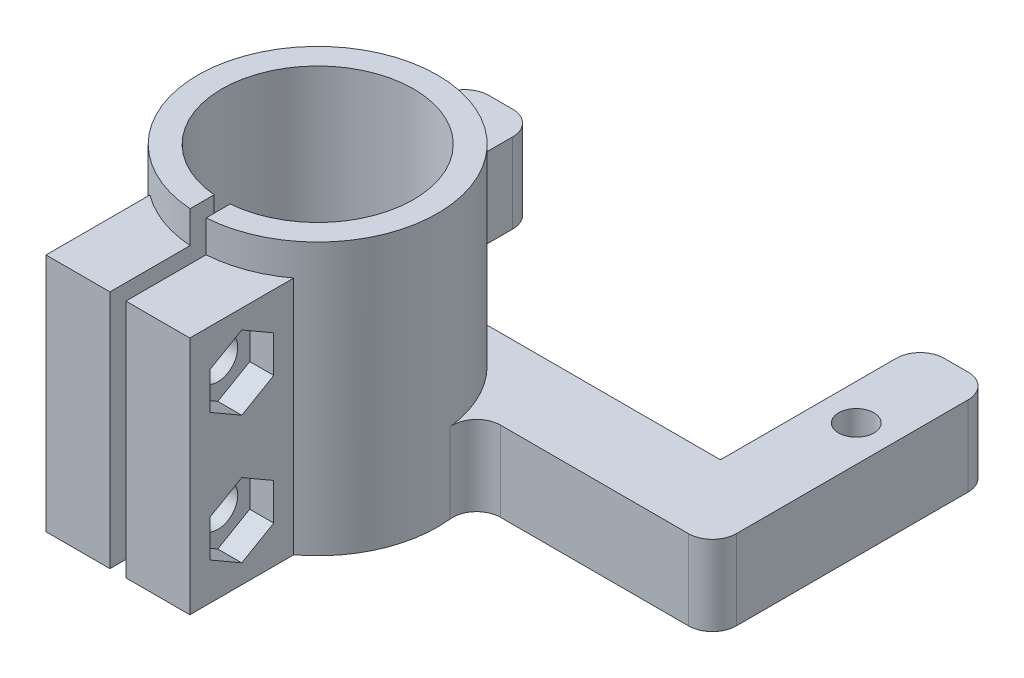
from build123d import *

# Parameters (mm, degrees)
SKETCH_1_R                  = 7.5
SKETCH_1_R_2                = 6
EXTRUDE_1_DEPTH             = 17
CUT_EXTRUDE_1_REACH         = 25.88
CUT_EXTRUDE_1_END_RADIUS    = 6
SKETCH_2_W                  = 1
SKETCH_2_H                  = 17
SKETCH_3_W                  = 4
SKETCH_3_H                  = 17
EXTRUDE_2_DEPTH             = 5
EXTRUDE_2_DIRECTION_2_REACH = 25.88
CUT_EXTRUDE_START           = -2
CUT_EXTRUDE_4_DEPTH         = 2
CUT_EXTRUDE_2_REACH         = 26.274
SKETCH_4_R                  = 1.25
CUT_EXTRUDE_3_DEPTH         = 1.5
EXTRUDE_6_DEPTH             = 5
SKETCH_13_W                 = 4.5
SKETCH_13_H                 = 12.5
EXTRUDE_7_DEPTH             = 5
CUT_EXTRUDE_5_REACH         = 34.2
SKETCH_11_R                 = 1.1
FILLET_1_R                  = 1.5


with BuildPart() as part:
    # 草图1 → 凸台-拉伸1 (new body)
    with BuildSketch(Plane(origin=(0, 0, 0), x_dir=(1, 0, 0), z_dir=(0, 1, 0))):
        with Locations(Location((0, 0, 0), (0, 0, 270))):
            Circle(SKETCH_1_R)
        with Locations(Location((0, 0, 0), (0, 0, 270))):
            Circle(SKETCH_1_R_2, mode=Mode.SUBTRACT)
    extrude(amount=EXTRUDE_1_DEPTH)

    # 切除-拉伸1: up to this cylinder (the profile starts outside it)
    cut_extrude_1_end = Plane(origin=(0, 8.5, 0), z_dir=(0, -1, 0)) * Cylinder(CUT_EXTRUDE_1_END_RADIUS, 64.76, mode=Mode.PRIVATE)
    # 草图2 → 切除-拉伸1 (cut, up to the surface)
    with BuildSketch(Plane.XY.offset(7.5), mode=Mode.PRIVATE) as cut_extrude_1_sk1:
        with Locations((0, 8.5)):
            Rectangle(SKETCH_2_W, SKETCH_2_H)
    cut_extrude_1_tool1 = extrude(cut_extrude_1_sk1.sketch, amount=-CUT_EXTRUDE_1_REACH, mode=Mode.PRIVATE) - cut_extrude_1_end
    add(cut_extrude_1_tool1.solids().sort_by_distance((0, 8.5, 7.5))[0], mode=Mode.SUBTRACT)

    # 草图3 → 凸台-拉伸2 (add)
    with BuildSketch(Plane.XY.offset(7.5)):
        with Locations((-2.5, 8.5)):
            Rectangle(SKETCH_3_W, SKETCH_3_H)
        with Locations((2.5, 8.5)):
            Rectangle(SKETCH_3_W, SKETCH_3_H)
    extrude(amount=EXTRUDE_2_DEPTH)

    # 草图3 → 凸台-拉伸2 direction 2 (add, up to next)
    with BuildSketch(Plane.XY.offset(7.5), mode=Mode.PRIVATE) as extrude_2_direction_2_sk1:
        with Locations((-2.5, 8.5)):
            Rectangle(SKETCH_3_W, SKETCH_3_H)
    extrude_2_direction_2_tool1 = extrude(extrude_2_direction_2_sk1.sketch, amount=-EXTRUDE_2_DIRECTION_2_REACH, mode=Mode.PRIVATE) - part.part
    # 草图3 → 凸台-拉伸2 direction 2 (add, up to next)
    with BuildSketch(Plane.XY.offset(7.5), mode=Mode.PRIVATE) as extrude_2_direction_2_sk2:
        with Locations((2.5, 8.5)):
            Rectangle(SKETCH_3_W, SKETCH_3_H)
    extrude_2_direction_2_tool2 = extrude(extrude_2_direction_2_sk2.sketch, amount=-EXTRUDE_2_DIRECTION_2_REACH, mode=Mode.PRIVATE) - part.part
    add(extrude_2_direction_2_tool1.solids().sort_by_distance((-2.5, 8.5, 7.5))[0])
    add(extrude_2_direction_2_tool2.solids().sort_by_distance((2.5, 8.5, 7.5))[0])

    # 草图7 → 切除-拉伸4 (cut)
    with BuildSketch(Plane(origin=(0, 17, 0), x_dir=(1, 0, 0), z_dir=(0, 1, 0)).offset(CUT_EXTRUDE_START)):
        with BuildLine():
            Line((-4.5, -6), (-4.5, -12.5))
            Line((-4.5, -12.5), (4.5, -12.5))
            Line((4.5, -12.5), (4.5, -6))
            ThreePointArc((4.5, -6), (0, -7.5), (-4.5, -6))
        make_face()
    extrude(amount=CUT_EXTRUDE_4_DEPTH, mode=Mode.SUBTRACT)

    # 切除-拉伸2: up to this face of the body (flat: up to its plane)
    cut_extrude_2_end = Plane(part.part.faces().sort_by_distance((4.5, 7.5, 9.25))[0])
    # 草图4 → 切除-拉伸2 (cut, up to the picked face)
    with BuildSketch(Plane.ZY.offset(4.5), mode=Mode.PRIVATE) as cut_extrude_2_sk1:
        with Locations(Location((9.25, 11.5, 0), (0, 0, 270))):
            Circle(SKETCH_4_R)
    cut_extrude_2_tool1 = split(extrude(cut_extrude_2_sk1.sketch, amount=-CUT_EXTRUDE_2_REACH, mode=Mode.PRIVATE), bisect_by=cut_extrude_2_end, keep=Keep.BOTH, mode=Mode.PRIVATE)
    # 草图4 → 切除-拉伸2 (cut, up to the picked face)
    with BuildSketch(Plane.ZY.offset(4.5), mode=Mode.PRIVATE) as cut_extrude_2_sk2:
        with Locations(Location((9.25, 3.5, 0), (0, 0, 270))):
            Circle(SKETCH_4_R)
    cut_extrude_2_tool2 = split(extrude(cut_extrude_2_sk2.sketch, amount=-CUT_EXTRUDE_2_REACH, mode=Mode.PRIVATE), bisect_by=cut_extrude_2_end, keep=Keep.BOTH, mode=Mode.PRIVATE)
    add(cut_extrude_2_tool1.solids().sort_by(Axis((-4.5, 11.5, 9.25), (1, 0, 0)))[0], mode=Mode.SUBTRACT)
    add(cut_extrude_2_tool2.solids().sort_by(Axis((-4.5, 3.5, 9.25), (1, 0, 0)))[0], mode=Mode.SUBTRACT)

    # 草图5 → 切除-拉伸3 (cut)
    with BuildSketch(Plane(origin=(4.5, 0, 0), x_dir=(0, 0, -1), z_dir=(1, 0, 0))):
        Polygon((-9.25, 9.190598923), (-7.25, 10.345299462), (-7.25, 12.654700538), (-9.25, 13.809401077), (-11.25, 12.654700538), (-11.25, 10.345299462), align=None)
        Polygon((-9.25, 1.190598923), (-7.25, 2.345299462), (-7.25, 4.654700538), (-9.25, 5.809401077), (-11.25, 4.654700538), (-11.25, 2.345299462), align=None)
    extrude(amount=-CUT_EXTRUDE_3_DEPTH, mode=Mode.SUBTRACT)

    # 草图12 → 凸台-拉伸6 (add)
    with BuildSketch(Plane(origin=(0, 0, 0), x_dir=(1, 0, 0), z_dir=(0, 1, 0))):
        Polygon((-10.8, 7.5), (22.2, 7.5), (22.2, 2.5), (7.071067812, 2.5), (0, 7.208487923), (-7.071067812, 2.5), (-10.8, 2.5), align=None)
    extrude(amount=EXTRUDE_6_DEPTH)

    # 草图13 → 凸台-拉伸7 (add)
    with BuildSketch(Plane(origin=(0, 0, 0), x_dir=(1, 0, 0), z_dir=(0, 1, 0))):
        with Locations((-8.55, 13.75)):
            Rectangle(SKETCH_13_W, SKETCH_13_H)
        with Locations((19.95, 13.75)):
            Rectangle(SKETCH_13_W, SKETCH_13_H)
    extrude(amount=EXTRUDE_7_DEPTH)

    # 草图11 → 切除-拉伸5 (cut, up to next)
    with BuildSketch(Plane(origin=(0, 5, 0), x_dir=(1, 0, 0), z_dir=(0, 1, 0)), mode=Mode.PRIVATE) as cut_extrude_5_sk1:
        with Locations(Location((-8.55, 13.75, 0), (0, 0, 270))):
            Circle(SKETCH_11_R)
    cut_extrude_5_tool1 = extrude(cut_extrude_5_sk1.sketch, amount=-CUT_EXTRUDE_5_REACH, mode=Mode.PRIVATE) & part.part
    # 草图11 → 切除-拉伸5 (cut, up to next)
    with BuildSketch(Plane(origin=(0, 5, 0), x_dir=(1, 0, 0), z_dir=(0, 1, 0)), mode=Mode.PRIVATE) as cut_extrude_5_sk2:
        with Locations(Location((19.95, 13.75, 0), (0, 0, 270))):
            Circle(SKETCH_11_R)
    cut_extrude_5_tool2 = extrude(cut_extrude_5_sk2.sketch, amount=-CUT_EXTRUDE_5_REACH, mode=Mode.PRIVATE) & part.part
    add(cut_extrude_5_tool1.solids().sort_by_distance((-8.55, 5, -13.75))[0], mode=Mode.SUBTRACT)
    add(cut_extrude_5_tool2.solids().sort_by_distance((19.95, 5, -13.75))[0], mode=Mode.SUBTRACT)

    # 圆角1
    fillet_1_edges = [part.edges().sort_by_distance(p)[0] for p in [
        (-10.8, 2.5, -2.5),
        (-7.071067812, 2.5, -2.5),
        (7.071067812, 2.5, -2.5),
        (22.2, 2.5, -2.5),
        (-10.8, 2.5, -20),
        (-6.3, 2.5, -20),
        (22.2, 2.5, -20),
        (17.7, 2.5, -20),
    ]]
    fillet(fillet_1_edges, radius=FILLET_1_R)


solid = part.part
